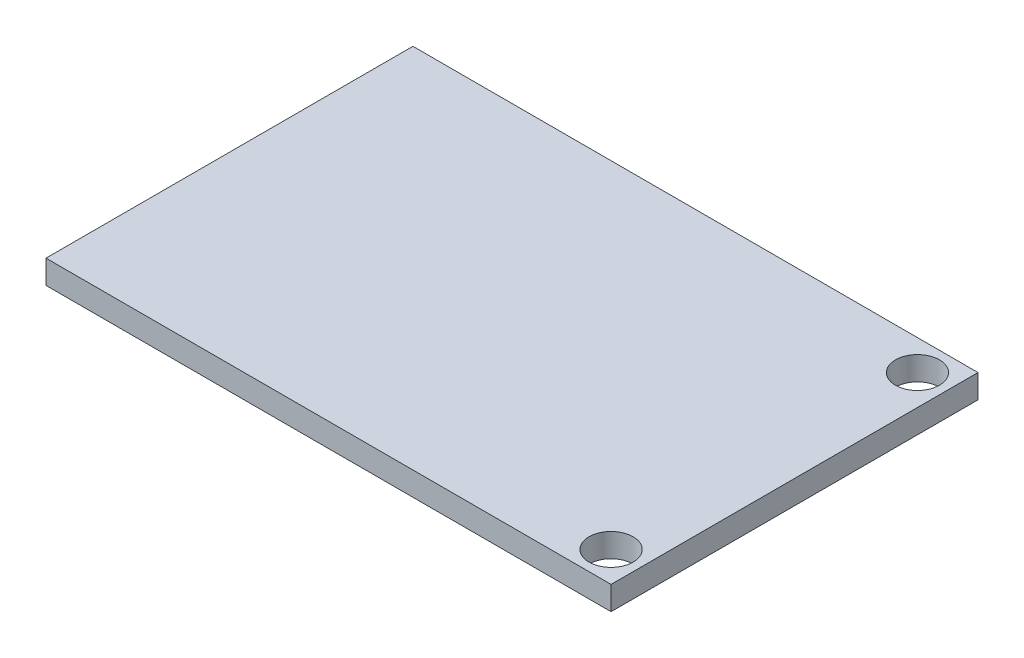
from build123d import *

# Parameters (mm, degrees)
SKETCH1_W           = 39.116
SKETCH1_H           = 25.4
BOSS_EXTRUDE1_DEPTH = 1.6383
SKETCH2_R           = 1.524
CUT_EXTRUDE1_DEPTH  = 1.6383


with BuildPart() as part:
    # Sketch1 → Boss-Extrude1 (new body)
    with BuildSketch(Plane(origin=(0, 0, 0), x_dir=(1, 0, 0), z_dir=(0, 1, 0))):
        Rectangle(SKETCH1_W, SKETCH1_H)
    extrude(amount=BOSS_EXTRUDE1_DEPTH)

    # Sketch2 → Cut-Extrude1 (cut)
    with BuildSketch(Plane(origin=(0, 1.6383, 0), x_dir=(1, 0, 0), z_dir=(0, 1, 0))):
        with Locations(Location((17.4625, -10.6045, 0), (0, 0, 270))):
            Circle(SKETCH2_R)
        with Locations(Location((17.4625, 10.6045, 0), (0, 0, 270))):
            Circle(SKETCH2_R)
    extrude(amount=-CUT_EXTRUDE1_DEPTH, mode=Mode.SUBTRACT)


solid = part.part
